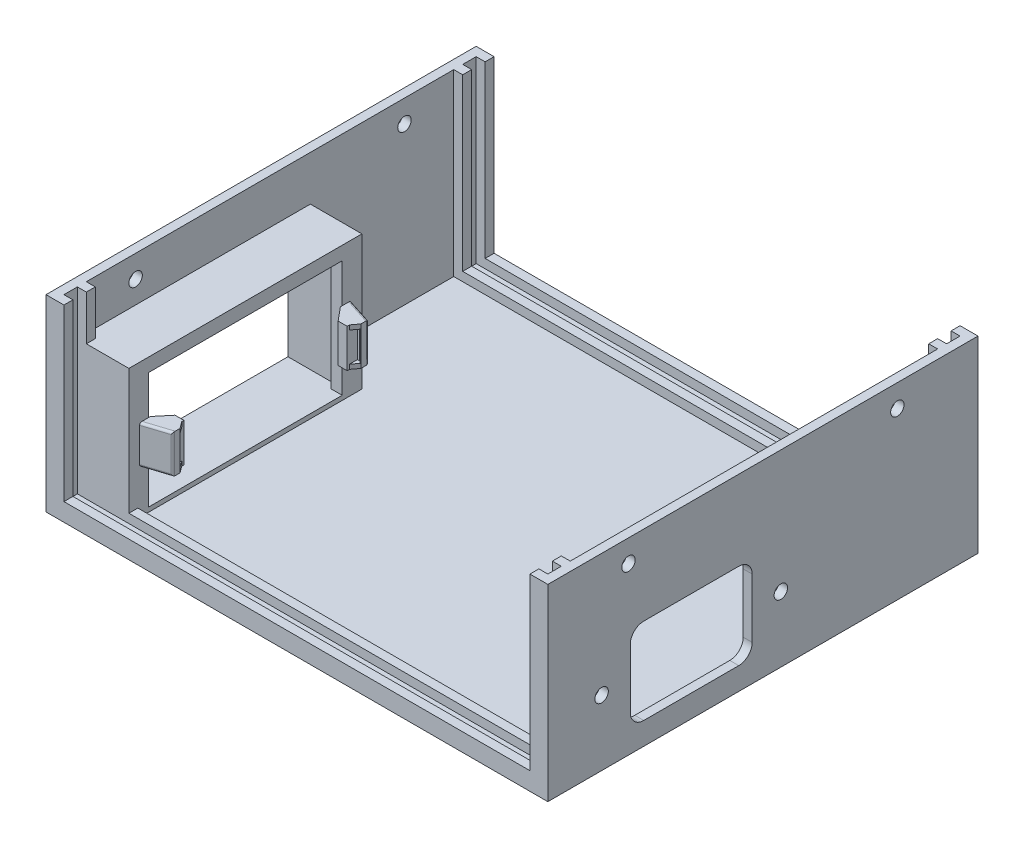
from build123d import *

# Parameters (mm, degrees)
ESBO_O1_W                = 112
ESBO_O1_H                = 96
RESSALTO_EXTRUS_O1_DEPTH = 2
ESBO_O2_W                = 108
ESBO_O2_H                = 3
ESBO_O2_H_2              = 82
RESSALTO_EXTRUS_O2_DEPTH = 40
ESBO_O3_W                = 104
ESBO_O3_H                = 38
CORTE_EXTRUS_O1_DEPTH    = 154.37535656
ESBO_O4_W                = 52
ESBO_O4_H                = 30
RESSALTO_EXTRUS_O3_DEPTH = 11.5
ESBO_O5_W                = 46
ESBO_O5_H                = 26
CORTE_EXTRUS_O2_DEPTH    = 12
ESBO_O6_W                = 43.2
ESBO_O6_H                = 26
CORTE_EXTRUS_O3_DEPTH    = 1.5
RESSALTO_EXTRUS_O4_DEPTH = 26
ESBO_O8_W                = 5.4
ESBO_O8_H                = 8.6
RESSALTO_EXTRUS_O5_DEPTH = 5.6
CORTE_EXTRUS_O4_DEPTH    = 8.6
CORTE_EXTRUS_O5_DEPTH    = 8.6
CORTE_EXTRUS_O6_DEPTH    = 8.6
CORTE_EXTRUS_O7_DEPTH    = 6.6
FILETE1_R                = 0.5
FILETE2_R                = 0.5
CORTE_EXTRUS_O8_DEPTH    = 2
ESBO_O16_R               = 1.5
CORTE_EXTRUS_O9_DEPTH    = 2
ESBO_O17_R               = 1.5
CORTE_EXTRUS_O10_DEPTH   = 154.37535656


with BuildPart() as part:
    # Esboço1 → Ressalto-extrusão1 (new body)
    with BuildSketch(Plane(origin=(0, 0, 0), x_dir=(1, 0, 0), z_dir=(0, 1, 0))):
        with Locations((56, 48)):
            Rectangle(ESBO_O1_W, ESBO_O1_H)
    extrude(amount=RESSALTO_EXTRUS_O1_DEPTH)

    # Esboço2 → Ressalto-extrusão2 (add)
    with BuildSketch(Plane(origin=(0, 2, 0), x_dir=(1, 0, 0), z_dir=(0, 1, 0))):
        Polygon((0, 96), (2, 96), (110, 96), (112, 96), (112, 0), (110, 0), (2, 0), (0, 0), align=None)
        with Locations((56, 92.5)):
            Rectangle(ESBO_O2_W, ESBO_O2_H, mode=Mode.SUBTRACT)
        with Locations((56, 3.5)):
            Rectangle(ESBO_O2_W, ESBO_O2_H, mode=Mode.SUBTRACT)
        with Locations((56, 48)):
            Rectangle(ESBO_O2_W, ESBO_O2_H_2, mode=Mode.SUBTRACT)
    extrude(amount=RESSALTO_EXTRUS_O2_DEPTH)

    # Esboço3 → Corte-extrusão1 (cut, through all)
    with BuildSketch(Plane.XY):
        with Locations((56, 23)):
            Rectangle(ESBO_O3_W, ESBO_O3_H)
    extrude(amount=-CORTE_EXTRUS_O1_DEPTH, mode=Mode.SUBTRACT)

    # Esboço4 → Ressalto-extrusão3 (add)
    with BuildSketch(Plane(origin=(2, 0, 0), x_dir=(0, 0, -1), z_dir=(1, 0, 0))):
        with Locations((31, 17)):
            Rectangle(ESBO_O4_W, ESBO_O4_H)
    extrude(amount=RESSALTO_EXTRUS_O3_DEPTH)

    # Esboço5 → Corte-extrusão2 (cut)
    with BuildSketch(Plane.ZY):
        with Locations((-31, 16)):
            Rectangle(ESBO_O5_W, ESBO_O5_H)
    extrude(amount=-CORTE_EXTRUS_O2_DEPTH, mode=Mode.SUBTRACT)

    # Esboço6 → Corte-extrusão3 (cut)
    with BuildSketch(Plane.ZY.offset(-12)):
        with Locations((-31, 16)):
            Rectangle(ESBO_O6_W, ESBO_O6_H)
    extrude(amount=-CORTE_EXTRUS_O3_DEPTH, mode=Mode.SUBTRACT)

    # Esboço7 → Ressalto-extrusão4 (add)
    with BuildSketch(Plane(origin=(0, 3, 0), x_dir=(1, 0, 0), z_dir=(0, 1, 0))):
        Polygon((12, 52.6), (12, 53.6), (11, 52.6), align=None)
        Polygon((12, 9.4), (12, 8.4), (11, 9.4), align=None)
    extrude(amount=RESSALTO_EXTRUS_O4_DEPTH)

    # Esboço8 → Ressalto-extrusão5 (add)
    with BuildSketch(Plane(origin=(13.5, 0, 0), x_dir=(0, 0, -1), z_dir=(1, 0, 0))):
        with Locations((10.1, 16)):
            Rectangle(ESBO_O8_W, ESBO_O8_H)
        with Locations((51.9, 16)):
            Rectangle(ESBO_O8_W, ESBO_O8_H)
    extrude(amount=RESSALTO_EXTRUS_O5_DEPTH)

    # Esboço9 → Corte-extrusão4 (cut)
    with BuildSketch(Plane(origin=(0, 20.3, 0), x_dir=(1, 0, 0), z_dir=(0, 1, 0))):
        Polygon((13.5, 54.6), (19.1, 52.8), (19.1, 54.6), align=None)
        Polygon((13.5, 7.4), (19.1, 7.4), (19.1, 9.2), align=None)
    extrude(amount=-CORTE_EXTRUS_O4_DEPTH, mode=Mode.SUBTRACT)

    # Esboço10 → Corte-extrusão5 (cut)
    with BuildSketch(Plane(origin=(0, 20.3, 0), x_dir=(1, 0, 0), z_dir=(0, 1, 0))):
        Polygon((13.5, 12.8), (16, 12.8), (13.5, 9.8), align=None)
        Polygon((13.5, 49.2), (16, 49.2), (13.5, 52.2), align=None)
    extrude(amount=-CORTE_EXTRUS_O5_DEPTH, mode=Mode.SUBTRACT)

    # Esboço11 → Corte-extrusão6 (cut)
    with BuildSketch(Plane(origin=(0, 20.3, 0), x_dir=(1, 0, 0), z_dir=(0, 1, 0))):
        Polygon((19.1, 49.2), (18, 49.2), (18, 49.7), (19.1, 51.2), align=None)
        Polygon((19.1, 12.8), (18, 12.8), (18, 12.3), (19.1, 10.8), align=None)
    extrude(amount=-CORTE_EXTRUS_O6_DEPTH, mode=Mode.SUBTRACT)

    # Esboço14 → Corte-extrusão7 (cut)
    with BuildSketch(Plane(origin=(0, 19.3, 0), x_dir=(1, 0, 0), z_dir=(0, 1, 0))):
        Polygon((18, 12.3), (18, 10.5), (18.5, 10.5), (19.033236994, 10.891040462), align=None)
        Polygon((18, 49.7), (18, 51.5), (18.5, 51.5), (19.033236994, 51.108959538), align=None)
    extrude(amount=-CORTE_EXTRUS_O7_DEPTH, mode=Mode.SUBTRACT)

    # Filete1
    filete1_edges = [part.edges().sort_by_distance(p)[0] for p in [
        (16.3, 11.7, -53.7),
        (19.1, 16, -52.8),
        (16.3, 20.3, -53.7),
    ]]
    fillet(filete1_edges, radius=FILETE1_R)

    # Filete2
    filete2_edges = [part.edges().sort_by_distance(p)[0] for p in [
        (16.3, 11.7, -8.3),
        (19.1, 16, -9.2),
        (16.3, 20.3, -8.3),
    ]]
    fillet(filete2_edges, radius=FILETE2_R)

    # Esboço15 → Corte-extrusão8 (cut)
    with BuildSketch(Plane(origin=(112, 0, 0), x_dir=(0, 0, -1), z_dir=(1, 0, 0))):
        with BuildLine():
            Line((21.4, 5), (42.6, 5))
            ThreePointArc((42.6, 5), (44.721320344, 5.878679656), (45.6, 8))
            Line((45.6, 8), (45.6, 21.2))
            ThreePointArc((45.6, 21.2), (44.721320344, 23.321320344), (42.6, 24.2))
            Line((42.6, 24.2), (21.4, 24.2))
            ThreePointArc((21.4, 24.2), (19.278679656, 23.321320344), (18.4, 21.2))
            Line((18.4, 21.2), (18.4, 8))
            ThreePointArc((18.4, 8), (19.278679656, 5.878679656), (21.4, 5))
        make_face()
    extrude(amount=-CORTE_EXTRUS_O8_DEPTH, mode=Mode.SUBTRACT)

    # Esboço16 → Corte-extrusão9 (cut)
    with BuildSketch(Plane(origin=(112, 0, 0), x_dir=(0, 0, -1), z_dir=(1, 0, 0))):
        with Locations((52, 14.6)):
            Circle(ESBO_O16_R)
        with Locations((12, 14.6)):
            Circle(ESBO_O16_R)
    extrude(amount=-CORTE_EXTRUS_O9_DEPTH, mode=Mode.SUBTRACT)

    # Esboço17 → Corte-extrusão10 (cut, through all)
    with BuildSketch(Plane.ZY):
        with Locations((-78, 37)):
            Circle(ESBO_O17_R)
        with Locations((-18, 37)):
            Circle(ESBO_O17_R)
    extrude(amount=-CORTE_EXTRUS_O10_DEPTH, mode=Mode.SUBTRACT)


solid = part.part
